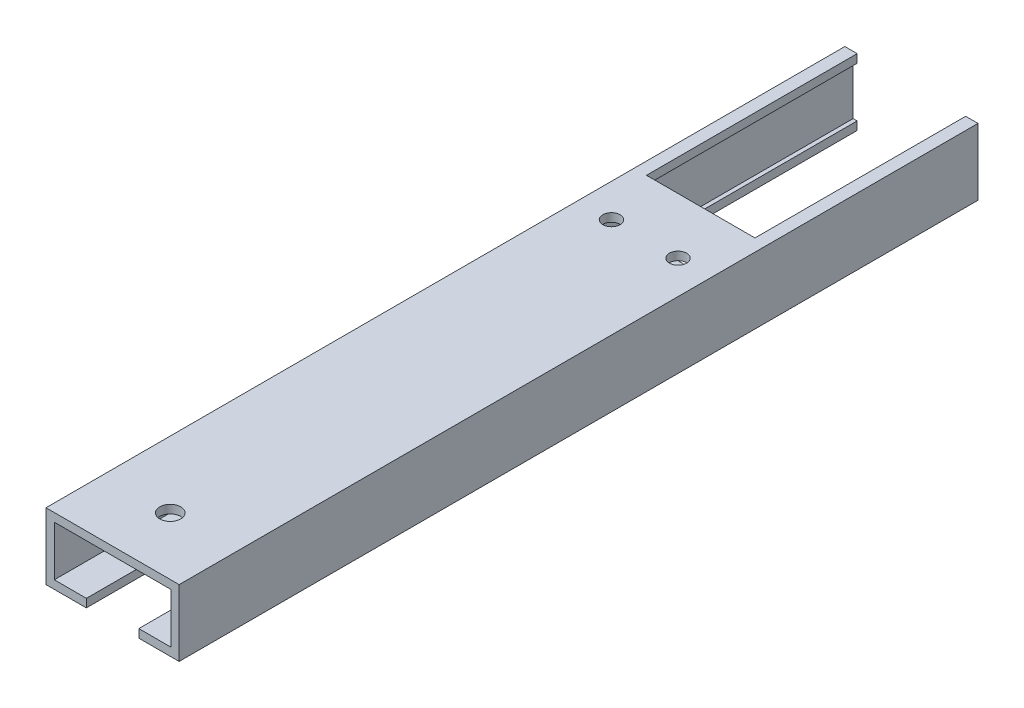
from build123d import *

# Parameters (mm, degrees)
SKETCH3_W               = 25.4
SKETCH3_H               = 12.7
SKETCH3_W_2             = 22.225
SKETCH3_H_2             = 9.525
BOSS_EXTRUDE1_DEPTH     = 152.4
SKETCH4_R               = 2
CUT_EXTRUDE1_DEPTH      = 1.5875
SKETCH5_R               = 1.500419334
CUT_EXTRUDE2_DEPTH      = 1.5875
CUT_EXTRUDE3_DEPTH      = 154.454683865
CUT_EXTRUDE3_DEPTH_BACK = 2.54
SKETCH7_W               = 20.700000002
SKETCH7_H               = 40.2
CUT_EXTRUDE4_DEPTH      = 154.454683865
M4X0_7_TAPPED_HOLE1_D   = 3.3


with BuildPart() as part:
    # Sketch3 → Boss-Extrude1 (new body)
    with BuildSketch(Plane.XY):
        Rectangle(SKETCH3_W, SKETCH3_H)
        Rectangle(SKETCH3_W_2, SKETCH3_H_2, mode=Mode.SUBTRACT)
    extrude(amount=BOSS_EXTRUDE1_DEPTH)

    # Sketch4 → Cut-Extrude1 (cut)
    with BuildSketch(Plane(origin=(0, 6.35, 0), x_dir=(1, 0, 0), z_dir=(0, 1, 0))):
        with Locations(Location((0, -141.4, 0), (0, 0, 270))):
            Circle(SKETCH4_R)
    extrude(amount=-CUT_EXTRUDE1_DEPTH, mode=Mode.SUBTRACT)

    # Sketch5 → Cut-Extrude2 (cut)
    with BuildSketch(Plane.XZ.offset(6.35)):
        with Locations((-8, 141.4)):
            Circle(SKETCH5_R)
        with Locations((0, 149.4)):
            Circle(SKETCH5_R)
        with Locations((8, 141.4)):
            Circle(SKETCH5_R)
    extrude(amount=-CUT_EXTRUDE2_DEPTH, mode=Mode.SUBTRACT)

    # Sketch6 → Cut-Extrude3 (cut, two sides: drawn at the far end of the back side and taken through both)
    with BuildSketch(Plane.XZ.offset(6.35).offset(-CUT_EXTRUDE3_DEPTH_BACK)):
        Polygon((-5, 469.248822712), (-5, 152.4), (-5, 136.4), (5, 136.4), (5, 152.4), (5, 469.248822712), (5, 1102.946468137), (-5, 1102.946468137), align=None)
    extrude(amount=CUT_EXTRUDE3_DEPTH + CUT_EXTRUDE3_DEPTH_BACK, mode=Mode.SUBTRACT)

    # Sketch7 → Cut-Extrude4 (cut, through all)
    with BuildSketch(Plane.XZ.offset(6.35)):
        with Locations((0, 20.1)):
            Rectangle(SKETCH7_W, SKETCH7_H)
    extrude(amount=-CUT_EXTRUDE4_DEPTH, mode=Mode.SUBTRACT)

    # M4x0.7 Tapped Hole1 (through all)
    with Locations(Plane(origin=(0, -6.35, 0), x_dir=(-1, 0, 0), z_dir=(0, -1, 0))):
        with Locations((-6.35, -50.875), (6.35, -50.875)):
            Hole(M4X0_7_TAPPED_HOLE1_D / 2)


solid = part.part
